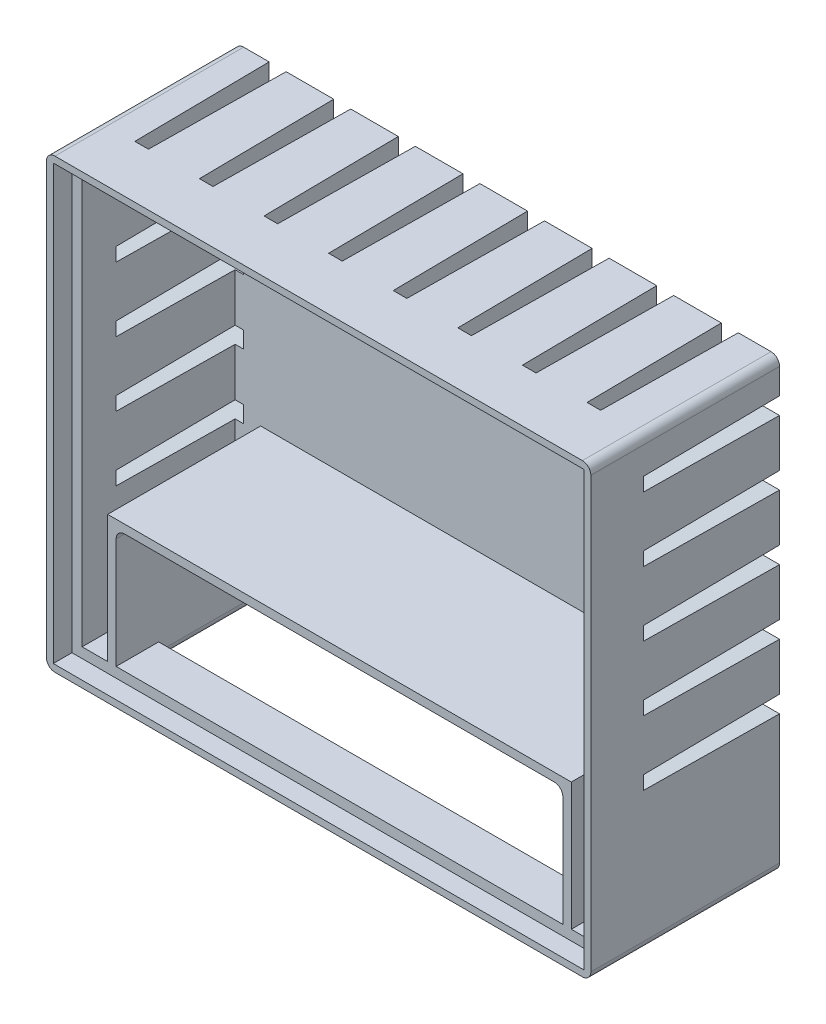
from build123d import *

# Parameters (mm, degrees)
SKETCH1_W            = 64.05
SKETCH1_H            = 52.6
BOSS_EXTRUDE1_DEPTH  = 2
SKETCH2_W            = 64.05
SKETCH2_H            = 52.6
SKETCH2_W_2          = 60.05
SKETCH2_H_2          = 48.6
BOSS_EXTRUDE2_DEPTH  = 18
SKETCH3_W            = 64.05
SKETCH3_H            = 52.6
SKETCH3_W_2          = 62.45
SKETCH3_H_2          = 51
BOSS_EXTRUDE3_DEPTH  = 2.2
SKETCH6_W            = 52.55
SKETCH6_H            = 16
CUT_EXTRUDE2_DEPTH   = 15
BOSS_EXTRUDE4_DEPTH  = 18
CUT_EXTRUDE3_DEPTH   = 3
LPATTERN1_COUNT      = 8
LPATTERN1_PITCH      = 7.6
CUT_EXTRUDE4_DEPTH   = 3
LPATTERN2_COUNT      = 5
LPATTERN2_PITCH      = 7.6
MIRROR1_COPY_1_DEPTH = 3
MIRROR1_COPY_2_DEPTH = 3
MIRROR1_COPY_3_DEPTH = 3
MIRROR1_COPY_4_DEPTH = 3
FILLET1_R            = 1
SKETCH10_W           = 52.55
SKETCH10_H           = 30
CUT_EXTRUDE5_DEPTH   = 0.2
FILLET2_R            = 2


with BuildPart() as part:
    # Sketch1 → Boss-Extrude1 (new body)
    with BuildSketch(Plane.XY):
        with Locations((29.525, 23.8)):
            Rectangle(SKETCH1_W, SKETCH1_H)
    extrude(amount=BOSS_EXTRUDE1_DEPTH)

    # Sketch2 → Boss-Extrude2 (add)
    with BuildSketch(Plane.XY.offset(2)):
        with Locations((29.525, 23.8)):
            Rectangle(SKETCH2_W, SKETCH2_H)
        with Locations((29.525, 23.8)):
            Rectangle(SKETCH2_W_2, SKETCH2_H_2, mode=Mode.SUBTRACT)
    extrude(amount=BOSS_EXTRUDE2_DEPTH)

    # Sketch3 → Boss-Extrude3 (add)
    with BuildSketch(Plane.XY.offset(20)):
        with Locations((29.525, 23.8)):
            Rectangle(SKETCH3_W, SKETCH3_H)
        with Locations((29.525, 23.8)):
            Rectangle(SKETCH3_W_2, SKETCH3_H_2, mode=Mode.SUBTRACT)
    extrude(amount=BOSS_EXTRUDE3_DEPTH)

    # Sketch6 → Cut-Extrude2 (cut)
    with BuildSketch(Plane(origin=(0, 0, 0), x_dir=(-1, 0, 0), z_dir=(0, 0, -1))):
        with Locations((-29.775, 5.5)):
            Rectangle(SKETCH6_W, SKETCH6_H)
    extrude(amount=-CUT_EXTRUDE2_DEPTH, mode=Mode.SUBTRACT)

    # Sketch7 → Boss-Extrude4 (add)
    with BuildSketch(Plane.XY.offset(2)):
        Polygon((56.05, 13.5), (56.05, -0.5), (57.05, -0.5), (57.05, 14.5), (2.5, 14.5), (2.5, -0.5), (3.5, -0.5), (3.5, 13.5), align=None)
    extrude(amount=BOSS_EXTRUDE4_DEPTH)

    # Sketch8 → Cut-Extrude3 (cut)
    with BuildSketch(Plane(origin=(0, 50.1, 0), x_dir=(1, 0, 0), z_dir=(0, 1, 0))):
        Polygon((1.5, 0), (3.5, 0), (3.3, -16), (1.7, -16), align=None)
    cut_extrude3 = extrude(amount=-CUT_EXTRUDE3_DEPTH, mode=Mode.SUBTRACT)

    # LPattern1: Cut-Extrude3 ×8
    with Locations(*[(i * LPATTERN1_PITCH, 0, 0) for i in range(1, LPATTERN1_COUNT)]):
        add(cut_extrude3, mode=Mode.SUBTRACT)

    # Sketch9 → Cut-Extrude4 (cut)
    with BuildSketch(Plane(origin=(61.55, 0, 0), x_dir=(0, 0, -1), z_dir=(1, 0, 0))):
        Polygon((0, 46.1), (0, 44.1), (-16, 44.3), (-16, 45.9), align=None)
    cut_extrude4 = extrude(amount=-CUT_EXTRUDE4_DEPTH, mode=Mode.SUBTRACT)

    # LPattern2: Cut-Extrude4 ×5
    with Locations(*[(0, -i * LPATTERN2_PITCH, 0) for i in range(1, LPATTERN2_COUNT)]):
        add(cut_extrude4, mode=Mode.SUBTRACT)

    # Mirror1: Cut-Extrude4 across plane
    add(cut_extrude4.mirror(Plane(origin=(29.525, 0, 0), x_dir=(0, 0, 1), z_dir=(1, 0, 0))), mode=Mode.SUBTRACT)

    # Mirror1 copy 1 sketch → Mirror1 copy 1 (cut)
    with BuildSketch(Plane(origin=(-2.5, -7.6, 0), x_dir=(0, 0, -1), z_dir=(-1, 0, 0))):
        Polygon((0, -46.1), (0, -44.1), (-16, -44.3), (-16, -45.9), align=None)
    extrude(amount=-MIRROR1_COPY_1_DEPTH, mode=Mode.SUBTRACT)

    # Mirror1 copy 2 sketch → Mirror1 copy 2 (cut)
    with BuildSketch(Plane(origin=(-2.5, -15.2, 0), x_dir=(0, 0, -1), z_dir=(-1, 0, 0))):
        Polygon((0, -46.1), (0, -44.1), (-16, -44.3), (-16, -45.9), align=None)
    extrude(amount=-MIRROR1_COPY_2_DEPTH, mode=Mode.SUBTRACT)

    # Mirror1 copy 3 sketch → Mirror1 copy 3 (cut)
    with BuildSketch(Plane(origin=(-2.5, -22.8, 0), x_dir=(0, 0, -1), z_dir=(-1, 0, 0))):
        Polygon((0, -46.1), (0, -44.1), (-16, -44.3), (-16, -45.9), align=None)
    extrude(amount=-MIRROR1_COPY_3_DEPTH, mode=Mode.SUBTRACT)

    # Mirror1 copy 4 sketch → Mirror1 copy 4 (cut)
    with BuildSketch(Plane(origin=(-2.5, -30.4, 0), x_dir=(0, 0, -1), z_dir=(-1, 0, 0))):
        Polygon((0, -46.1), (0, -44.1), (-16, -44.3), (-16, -45.9), align=None)
    extrude(amount=-MIRROR1_COPY_4_DEPTH, mode=Mode.SUBTRACT)

    # Fillet1
    fillet1_edges = [part.edges().sort_by_distance(p)[0] for p in [
        (56.05, 13.5, 10),
        (3.5, 13.5, 10),
        (3.5, -2.5, 7.5),
        (56.05, -2.5, 7.5),
        (-2.5, 50.1, 11.1),
        (61.55, 50.1, 11.1),
        (61.55, -2.5, 11.1),
        (-2.5, -2.5, 11.1),
    ]]
    fillet(fillet1_edges, radius=FILLET1_R)

    # Sketch10 → Cut-Extrude5 (cut)
    with BuildSketch(Plane(origin=(0, 0, 0), x_dir=(-1, 0, 0), z_dir=(0, 0, -1))):
        with Locations((-29.775, 30.5)):
            Rectangle(SKETCH10_W, SKETCH10_H)
    extrude(amount=-CUT_EXTRUDE5_DEPTH, mode=Mode.SUBTRACT)

    # Fillet2
    fillet2_edges = [part.edges().sort_by_distance(p)[0] for p in [
        (3.5, 45.5, 0.1),
        (3.5, 15.5, 0.1),
        (56.05, 15.5, 0.1),
        (56.05, 45.5, 0.1),
    ]]
    fillet(fillet2_edges, radius=FILLET2_R)


solid = part.part
